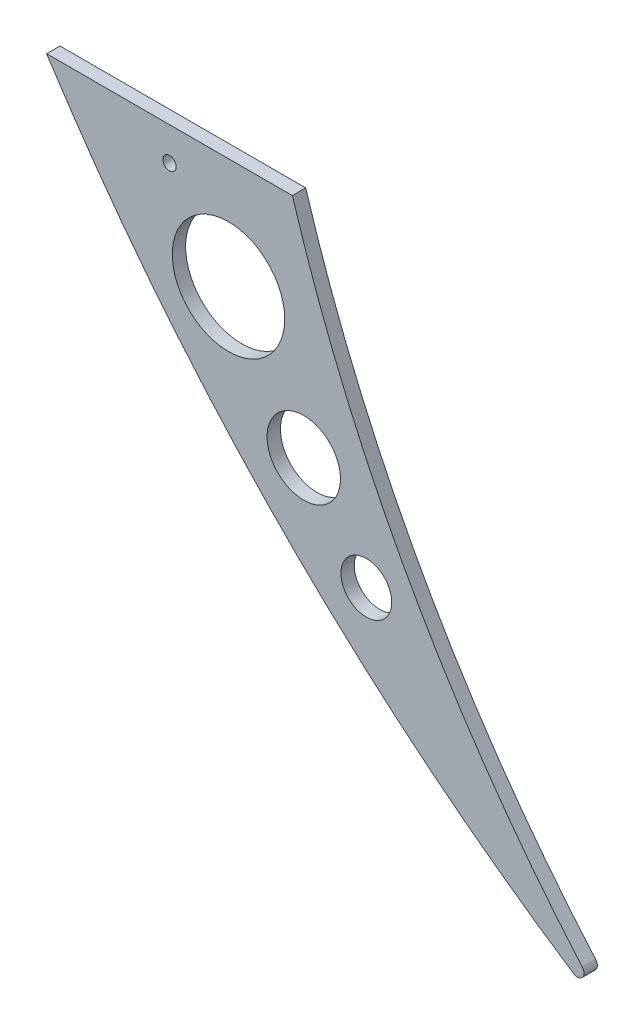
from build123d import *

# Parameters (mm, degrees)
CROQUIS1_R              = 3.811830968
CROQUIS1_R_2            = 8.433713649
CROQUIS1_R_3            = 5.50644924
CROQUIS1_R_4            = 1
SALIENTE_EXTRUIR1_DEPTH = 2


with BuildPart() as part:
    # Croquis1 → Saliente-Extruir1 (new body)
    with BuildSketch(Plane.XY):
        with BuildLine():
            Line((4031.0864923, 1267.998645222), (3994.220839377, 1267.998645222))
            ThreePointArc((3994.220839377, 1267.998645222), (4029.544836626, 1223.835026243), (4073.293708821, 1187.998645222))
            ThreePointArc((4073.293708821, 1187.998645222), (4074.595594818, 1188.175999527), (4074.598031282, 1189.48990811))
            ThreePointArc((4074.598031282, 1189.48990811), (4048.728408118, 1226.464274325), (4031.0864923, 1267.998645222))
        make_face()
        with Locations((4042.182467754, 1222.589537582)):
            Circle(CROQUIS1_R, mode=Mode.SUBTRACT)
        with Locations((4021.504921686, 1251.374870701)):
            Circle(CROQUIS1_R_2, mode=Mode.SUBTRACT)
        with Locations((4032.794850615, 1234.777177731)):
            Circle(CROQUIS1_R_3, mode=Mode.SUBTRACT)
        with Locations((4012.653665839, 1262.998645222)):
            Circle(CROQUIS1_R_4, mode=Mode.SUBTRACT)
    extrude(amount=SALIENTE_EXTRUIR1_DEPTH)


solid = part.part
